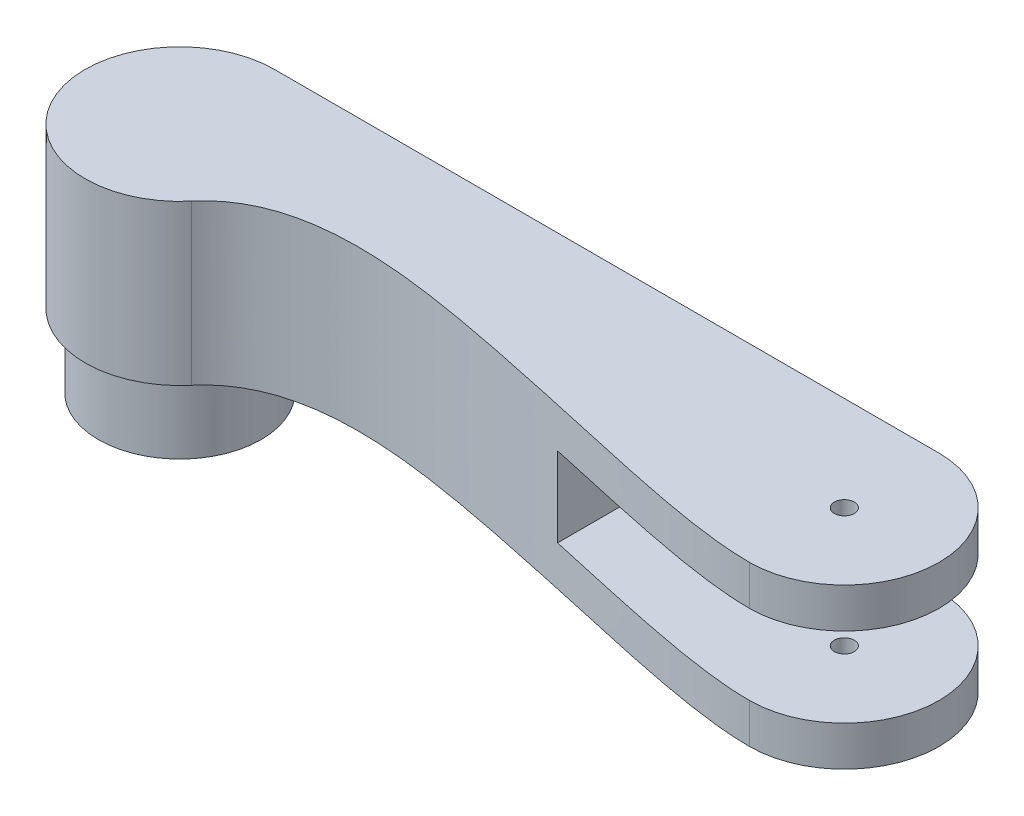
from build123d import *

# Parameters (mm, degrees)
BOSS_EXTRUDE1_DEPTH = 6
SKETCH3_R           = 1.5
CUT_EXTRUDE2_DEPTH  = 67.08422656
BOSS_EXTRUDE2_DEPTH = 12
BOSS_EXTRUDE3_DEPTH = 6
CUT_EXTRUDE3_REACH  = 72.051
SKETCH6_R           = 1.5
CUT_EXTRUDE4_REACH  = 72.051
SKETCH8_R           = 12.25
BOSS_EXTRUDE4_DEPTH = 11
SKETCH9_R           = 2.5
SKETCH9_R_2         = 3
CUT_EXTRUDE5_DEPTH  = 6


with BuildPart() as part:
    # Sketch1 → Boss-Extrude1 (new body)
    with BuildSketch(Plane(origin=(0, 0, 0), x_dir=(1, 0, 0), z_dir=(0, 1, 0))):
        with BuildLine():
            Line((-50, 14.25), (50, 14.25))
            ThreePointArc((50, 14.25), (64.25, 0), (50, -14.25))
            Line((50, -14.25), (-50, -14.25))
            ThreePointArc((-50, -14.25), (-64.25, 0), (-50, 14.25))
        make_face()
    extrude(amount=BOSS_EXTRUDE1_DEPTH)

    # Sketch3 → Cut-Extrude2 (cut, through all)
    with BuildSketch(Plane.XZ):
        with Locations(Location((50, 0, 0), (0, 0, 270))):
            Circle(SKETCH3_R)
    extrude(amount=-CUT_EXTRUDE2_DEPTH, mode=Mode.SUBTRACT)

    # Sketch4 → Boss-Extrude2 (add)
    with BuildSketch(Plane(origin=(0, 6, 0), x_dir=(1, 0, 0), z_dir=(0, 1, 0))):
        with BuildLine():
            Line((-50, 14.25), (15, 14.25))
            Line((15, 14.25), (15, -14.25))
            Line((15, -14.25), (-50, -14.25))
            ThreePointArc((-50, -14.25), (-64.25, 0), (-50, 14.25))
        make_face()
    extrude(amount=BOSS_EXTRUDE2_DEPTH)

    # Sketch5 → Boss-Extrude3 (add)
    with BuildSketch(Plane(origin=(0, 18, 0), x_dir=(1, 0, 0), z_dir=(0, 1, 0))):
        with BuildLine():
            Line((-50, 14.25), (50, 14.25))
            ThreePointArc((50, 14.25), (64.25, 0), (50, -14.25))
            Line((50, -14.25), (-50, -14.25))
            ThreePointArc((-50, -14.25), (-64.25, 0), (-50, 14.25))
        make_face()
    extrude(amount=BOSS_EXTRUDE3_DEPTH)

    # Sketch6 → Cut-Extrude3 (cut, up to next)
    with BuildSketch(Plane(origin=(0, 24, 0), x_dir=(1, 0, 0), z_dir=(0, 1, 0)), mode=Mode.PRIVATE) as cut_extrude3_sk1:
        with Locations(Location((50, 0, 0), (0, 0, 90))):
            Circle(SKETCH6_R)
    cut_extrude3_tool1 = extrude(cut_extrude3_sk1.sketch, amount=-CUT_EXTRUDE3_REACH, mode=Mode.PRIVATE) & part.part
    add(cut_extrude3_tool1.solids().sort_by_distance((50, 24, 0))[0], mode=Mode.SUBTRACT)

    # Sketch7 → Cut-Extrude4 (cut, up to next)
    with BuildSketch(Plane(origin=(0, 24, 0), x_dir=(1, 0, 0), z_dir=(0, 1, 0)), mode=Mode.PRIVATE) as cut_extrude4_sk1:
        with BuildLine():
            ThreePointArc((-39.07315683, -9.146944754), (-43.970135273, -12.911360555), (-50, -14.25))
            Line((-50, -14.25), (50, -14.25))
            add(Edge.make_bspline(
                [(-39.07315683, -9.146944754), (-31.514094033, -0.116968526), (5.438655837, -4.645240543), (38.697514387, -14.25), (50, -14.25)],
                knots=[0, 0, 0, 0, 0.435907903, 1, 1, 1, 1], degree=3))
        make_face()
    cut_extrude4_tool1 = extrude(cut_extrude4_sk1.sketch, amount=-CUT_EXTRUDE4_REACH, mode=Mode.PRIVATE) & part.part
    add(cut_extrude4_tool1.solids().sort_by_distance((-8.590717, 24, 9.791359))[0], mode=Mode.SUBTRACT)

    # Sketch8 → Boss-Extrude4 (add)
    with BuildSketch(Plane.XZ):
        with Locations(Location((-50, 0, 0), (0, 0, 90))):
            Circle(SKETCH8_R)
    extrude(amount=BOSS_EXTRUDE4_DEPTH)

    # Sketch9 → Cut-Extrude5 (cut)
    with BuildSketch(Plane.XZ.offset(11)):
        with Locations(Location((-50, 7.5, 0), (0, 0, 270))):
            Circle(SKETCH9_R)
        with Locations(Location((-50, -7.5, 0), (0, 0, 270))):
            Circle(SKETCH9_R)
        with Locations(Location((-50, 0, 0), (0, 0, 270))):
            Circle(SKETCH9_R_2)
    extrude(amount=-CUT_EXTRUDE5_DEPTH, mode=Mode.SUBTRACT)


solid = part.part
